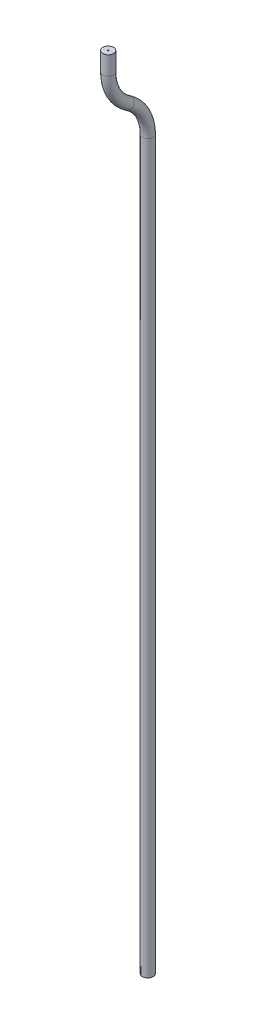
from build123d import *

# Parameters (mm, degrees)
UTILITY_CIRCULAR_CROSS_SECTION_R   = 1.75
UTILITY_CIRCULAR_CROSS_SECTION_R_2 = 0.18


with BuildPart() as part:
    # Native hollow utility sweep: sweep along a path in Illustrative smooth utility route
    with BuildLine(Plane(origin=(0, 0, 0), x_dir=(0, 0, -1), z_dir=(1, 0, 0))) as native_hollow_utility_sweep_path:
        Line((-17.35, 0), (-17.35, -6))
        ThreePointArc((-17.35, -6), (-15.642666611, -12.80589129), (-10.925, -18))
        ThreePointArc((-10.925, -18), (-6.207333389, -23.19410871), (-4.5, -30))
        Line((-4.5, -30), (-4.5, -266))
    # Utility circular cross section → Native hollow utility sweep (sweep)
    with BuildSketch(Plane(origin=(0, 0, 0), x_dir=(1, 0, 0), z_dir=(0, 1, 0))):
        with Locations((0, -17.35)):
            Circle(UTILITY_CIRCULAR_CROSS_SECTION_R)
        with Locations((0, -17.35)):
            Circle(UTILITY_CIRCULAR_CROSS_SECTION_R_2, mode=Mode.SUBTRACT)
    sweep(path=native_hollow_utility_sweep_path.line)


solid = part.part
